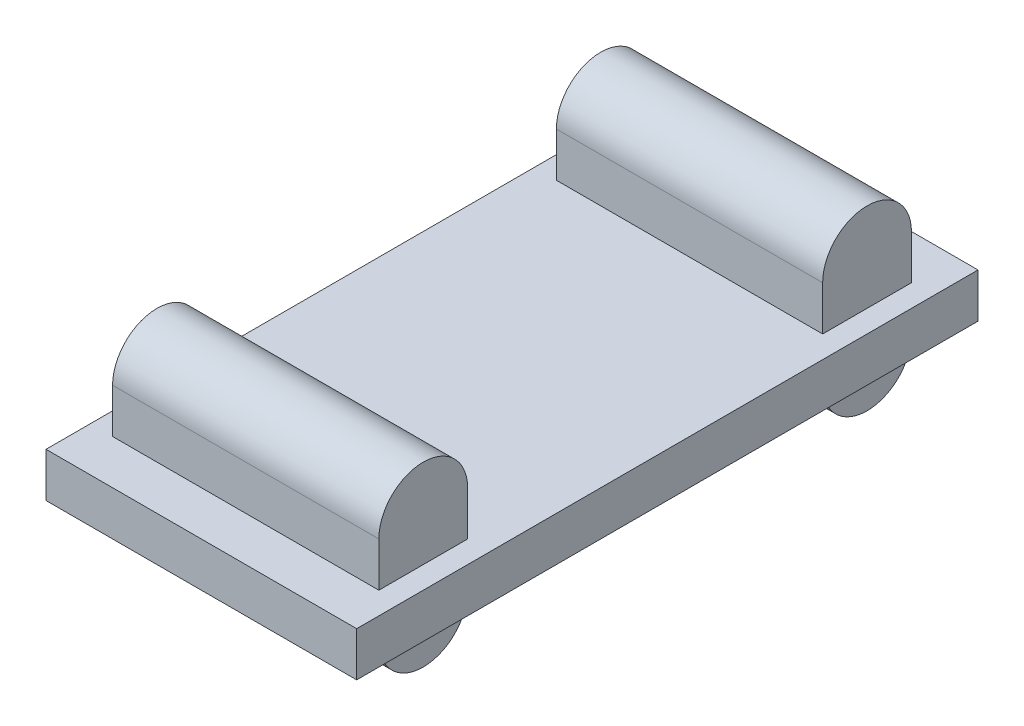
from build123d import *

# Parameters (mm, degrees)
SKETCH1_W           = 177.8
SKETCH1_H           = 355.6
BOSS_EXTRUDE1_DEPTH = 12.7
BOSS_EXTRUDE2_DEPTH = 76.2


with BuildPart() as part:
    # Sketch1 → Boss-Extrude1 (new, symmetric)
    with BuildSketch(Plane(origin=(0, 0, 0), x_dir=(1, 0, 0), z_dir=(0, 1, 0))):
        Rectangle(SKETCH1_W, SKETCH1_H)
    extrude(amount=BOSS_EXTRUDE1_DEPTH, both=True)

    # Sketch2 → Boss-Extrude2 (add, symmetric)
    with BuildSketch(Plane(origin=(0, 0, 0), x_dir=(0, 0, -1), z_dir=(1, 0, 0))):
        with BuildLine():
            Line((-152.4, -12.7), (-152.4, 38.1))
            ThreePointArc((-152.4, 38.1), (-127, 63.5), (-101.6, 38.1))
            Line((-101.6, 38.1), (-101.6, -12.7))
            ThreePointArc((-101.6, -12.7), (-127, -38.1), (-152.4, -12.7))
        make_face()
        with BuildLine():
            Line((101.6, -12.7), (101.6, 38.1))
            ThreePointArc((101.6, 38.1), (127, 63.5), (152.4, 38.1))
            Line((152.4, 38.1), (152.4, -12.7))
            ThreePointArc((152.4, -12.7), (127, -38.1), (101.6, -12.7))
        make_face()
    extrude(amount=BOSS_EXTRUDE2_DEPTH, both=True)


solid = part.part
